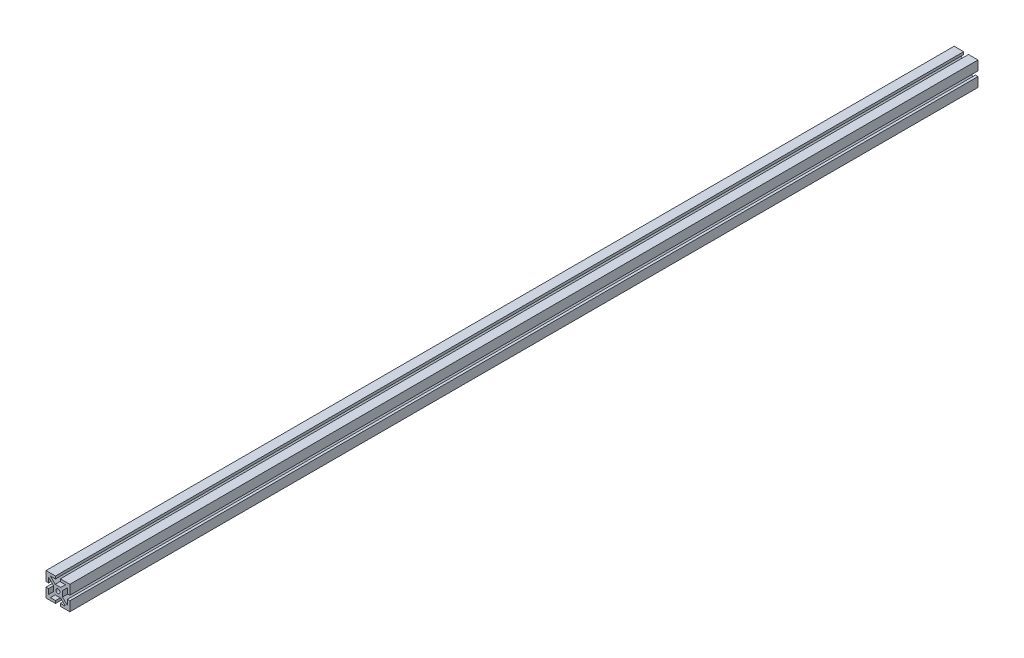
from build123d import *

# Parameters (mm, degrees)
SKETCH1_R           = 3.4
BOSS_EXTRUDE1_DEPTH = 1524


with BuildPart() as part:
    # Sketch1 → Boss-Extrude1 (new body)
    with BuildSketch(Plane.XY):
        Polygon((0, 0), (15.94, 0), (15.94, 4.32), (7.374701295, 4.32), (15.369701295, 12.315), (24.630298705, 12.315), (32.625298705, 4.32), (24.06, 4.32), (24.06, 0), (40, 0), (40, 15.94), (35.68, 15.94), (35.68, 7.374701295), (27.685, 15.369701295), (27.685, 24.630298705), (35.68, 32.625298705), (35.68, 24.06), (40, 24.06), (40, 40), (24.06, 40), (24.06, 35.68), (32.625298705, 35.68), (24.630298705, 27.685), (15.369701295, 27.685), (7.374701295, 35.68), (15.94, 35.68), (15.94, 40), (0, 40), (0, 24.06), (4.32, 24.06), (4.32, 32.625298705), (12.315, 24.630298705), (12.315, 15.369701295), (4.32, 7.374701295), (4.32, 15.94), (0, 15.94), align=None)
        with Locations((20, 20)):
            Circle(SKETCH1_R, mode=Mode.SUBTRACT)
    extrude(amount=BOSS_EXTRUDE1_DEPTH)


solid = part.part
